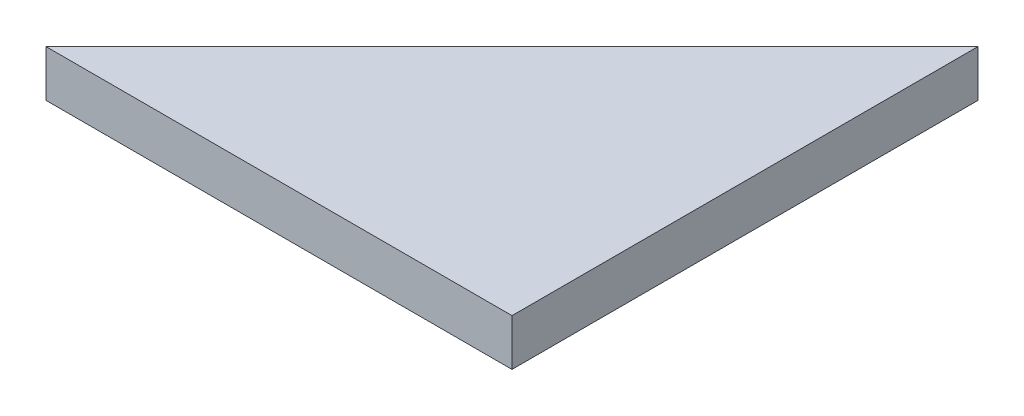
from build123d import *

# Parameters (mm, degrees)
EXTRUDE_1_DEPTH = 3


with BuildPart() as part:
    # 草图1 → 凸台-拉伸1 (new body)
    with BuildSketch(Plane(origin=(0, 0, 0), x_dir=(1, 0, 0), z_dir=(0, 1, 0))):
        Polygon((0, 0), (-30, 0), (0, 30), align=None)
    extrude(amount=EXTRUDE_1_DEPTH)


solid = part.part
